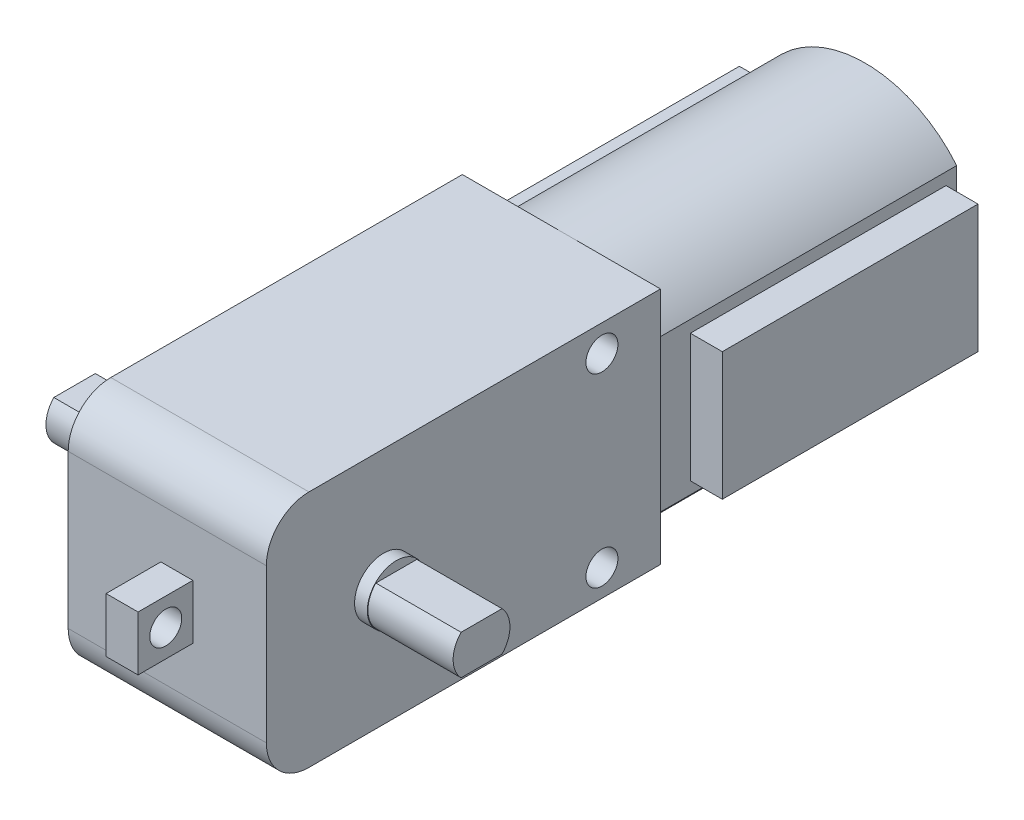
from build123d import *

# Parameters (mm, degrees)
SKETCH1_W            = 37
SKETCH1_H            = 22.4
BOSS_EXTRUDE1_DEPTH  = 18.6
FILLET1_R            = 4
SKETCH2_R            = 3.65
BOSS_EXTRUDE2_DEPTH  = 1.2
SKETCH3_R            = 2.73
BOSS_EXTRUDE3_DEPTH  = 1.2
BOSS_EXTRUDE4_DEPTH  = 8
SKETCH5_R            = 2.72
BOSS_EXTRUDE5_DEPTH  = 1.2
BOSS_EXTRUDE6_DEPTH  = 8
SKETCH7_R            = 2
BOSS_EXTRUDE7_DEPTH  = 2.4
SKETCH8_W            = 5.14
SKETCH8_H            = 5.12
BOSS_EXTRUDE8_DEPTH  = 1.5
BOSS_EXTRUDE10_DEPTH = 28
SKETCH12_W           = 24
SKETCH12_H           = 12
BOSS_EXTRUDE11_DEPTH = 3
SKETCH13_R           = 1.5
CUT_EXTRUDE1_DEPTH   = 28
SKETCH14_R           = 1.5
CUT_EXTRUDE2_DEPTH   = 28


with BuildPart() as part:
    # Sketch1 → Boss-Extrude1 (new body)
    with BuildSketch(Plane(origin=(0, 0, 0), x_dir=(0, 0, -1), z_dir=(1, 0, 0))):
        Rectangle(SKETCH1_W, SKETCH1_H)
    extrude(amount=BOSS_EXTRUDE1_DEPTH)

    # Fillet1
    fillet1_edges = [part.edges().sort_by_distance(p)[0] for p in [
        (9.3, 11.2, 18.5),
        (9.3, -11.2, 18.5),
    ]]
    fillet(fillet1_edges, radius=FILLET1_R)

    # Sketch2 → Boss-Extrude2 (add)
    with BuildSketch(Plane.ZY):
        with Locations(Location((7.5, 0, 0), (0, 0, 180))):
            Circle(SKETCH2_R)
    extrude(amount=BOSS_EXTRUDE2_DEPTH)

    # Sketch3 → Boss-Extrude3 (add)
    with BuildSketch(Plane.ZY.offset(1.2)):
        with Locations((7.5, 0)):
            Circle(SKETCH3_R)
    extrude(amount=BOSS_EXTRUDE3_DEPTH)

    # Sketch4 → Boss-Extrude4 (add)
    with BuildSketch(Plane.ZY.offset(2.4)):
        with BuildLine():
            Line((5.552798511, -1.85), (9.447201489, -1.85))
            ThreePointArc((9.447201489, -1.85), (10.185906483, 0), (9.447201489, 1.85))
            Line((9.447201489, 1.85), (5.552798511, 1.85))
            ThreePointArc((5.552798511, 1.85), (4.814093517, 0), (5.552798511, -1.85))
        make_face()
    extrude(amount=BOSS_EXTRUDE4_DEPTH)

    # Sketch5 → Boss-Extrude5 (add)
    with BuildSketch(Plane(origin=(18.6, 0, 0), x_dir=(0, 0, -1), z_dir=(1, 0, 0))):
        with Locations((-7.5, 0)):
            Circle(SKETCH5_R)
    extrude(amount=BOSS_EXTRUDE5_DEPTH)

    # Sketch6 → Boss-Extrude6 (add)
    with BuildSketch(Plane(origin=(19.8, 0, 0), x_dir=(0, 0, -1), z_dir=(1, 0, 0))):
        with BuildLine():
            Line((-9.419930554, -1.85), (-5.580069446, -1.85))
            ThreePointArc((-5.580069446, -1.85), (-4.833797957, 0), (-5.580069446, 1.85))
            Line((-5.580069446, 1.85), (-9.419930554, 1.85))
            ThreePointArc((-9.419930554, 1.85), (-10.166202043, 0), (-9.419930554, -1.85))
        make_face()
    extrude(amount=BOSS_EXTRUDE6_DEPTH)

    # Sketch7 → Boss-Extrude7 (add)
    with BuildSketch(Plane.ZY):
        with Locations(Location((-3.9, 0, 0), (0, 0, 180))):
            Circle(SKETCH7_R)
    extrude(amount=BOSS_EXTRUDE7_DEPTH)

    # Sketch8 → Boss-Extrude8 (add, symmetric)
    with BuildSketch(Plane.ZY.offset(-10.2)):
        with Locations((21.07, 0)):
            Rectangle(SKETCH8_W, SKETCH8_H)
    extrude(amount=BOSS_EXTRUDE8_DEPTH, both=True)

    # Sketch11 → Boss-Extrude10 (add)
    with BuildSketch(Plane(origin=(0, 0, -18.5), x_dir=(-1, 0, 0), z_dir=(0, 0, -1))):
        with BuildLine():
            Line((-18.4, 7.128036195), (-18.4, -7.128036195))
            ThreePointArc((-18.4, -7.128036195), (-9.8, -11.17), (-1.2, -7.128036195))
            Line((-1.2, -7.128036195), (-1.2, 7.128036195))
            ThreePointArc((-1.2, 7.128036195), (-9.8, 11.17), (-18.4, 7.128036195))
        make_face()
    extrude(amount=BOSS_EXTRUDE10_DEPTH)

    # Sketch12 → Boss-Extrude11 (add)
    with BuildSketch(Plane(origin=(18.4, 0, 0), x_dir=(0, 0, -1), z_dir=(1, 0, 0))):
        with Locations((33.5, 0)):
            Rectangle(SKETCH12_W, SKETCH12_H)
    boss_extrude11 = extrude(amount=BOSS_EXTRUDE11_DEPTH)

    # Mirror1: Boss-Extrude11 across plane
    add(boss_extrude11.mirror(Plane.ZY.offset(-10.2)))

    # Sketch13 → Cut-Extrude1 (cut)
    with BuildSketch(Plane(origin=(18.6, 0, 0), x_dir=(0, 0, -1), z_dir=(1, 0, 0))):
        with Locations((13, -8.7)):
            Circle(SKETCH13_R)
    cut_extrude1 = extrude(amount=-CUT_EXTRUDE1_DEPTH, mode=Mode.SUBTRACT)

    # Mirror2: Cut-Extrude1 across plane
    add(cut_extrude1.mirror(Plane.ZX), mode=Mode.SUBTRACT)

    # Sketch14 → Cut-Extrude2 (cut)
    with BuildSketch(Plane.ZY.offset(-8.7)):
        with Locations((21.04, 0)):
            Circle(SKETCH14_R)
    extrude(amount=-CUT_EXTRUDE2_DEPTH, mode=Mode.SUBTRACT)


solid = part.part
